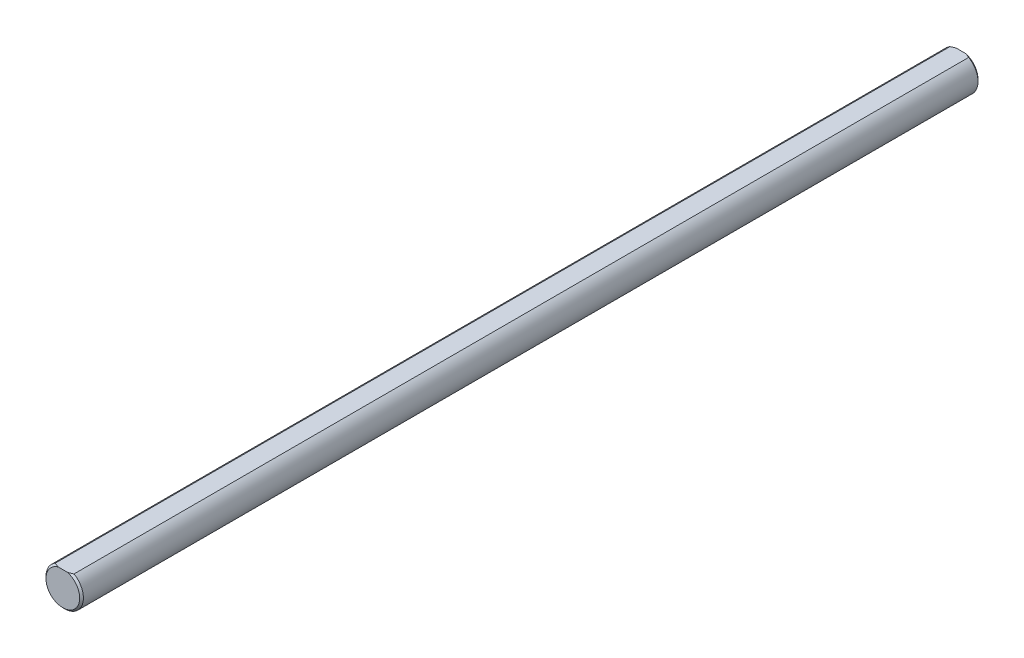
from build123d import *

# Parameters (mm, degrees)
BOSS_EXTRUDE2_DEPTH      = 76.2
BOSS_EXTRUDE2_DEPTH_BACK = 76.2
SKETCH3_R                = 3.175
CUT_EXTRUDE5_DEPTH       = 77.332177029
CUT_EXTRUDE5_DEPTH_BACK  = 77.332177029
CHAMFER1_SIZE            = 0.3175


with BuildPart() as part:
    # Sketch3 → Boss-Extrude2 (new, two sides: drawn at the far end of the back side and taken through both)
    with BuildSketch(Plane.XY.offset(-BOSS_EXTRUDE2_DEPTH_BACK)):
        with Locations(Location((0, 0, 0), (0, 0, 180))):
            Circle(SKETCH3_R)
    extrude(amount=BOSS_EXTRUDE2_DEPTH + BOSS_EXTRUDE2_DEPTH_BACK)

    # Sketch10 → Cut-Extrude5 (cut, two sides: drawn at the far end of the back side and taken through both)
    with BuildSketch(Plane.XY.offset(-CUT_EXTRUDE5_DEPTH_BACK)):
        with BuildLine():
            Line((-1.5875, 2.749630657), (1.5875, 2.749630657))
            ThreePointArc((1.5875, 2.749630657), (0, 3.175), (-1.5875, 2.749630657))
        make_face()
    extrude(amount=CUT_EXTRUDE5_DEPTH + CUT_EXTRUDE5_DEPTH_BACK, mode=Mode.SUBTRACT)

    # Chamfer1
    chamfer1_edges = [part.edges().sort_by_distance(p)[0] for p in [
        (0, -3.175, -76.2),
        (0, -3.175, 76.2),
    ]]
    chamfer(chamfer1_edges, length=CHAMFER1_SIZE)


solid = part.part
